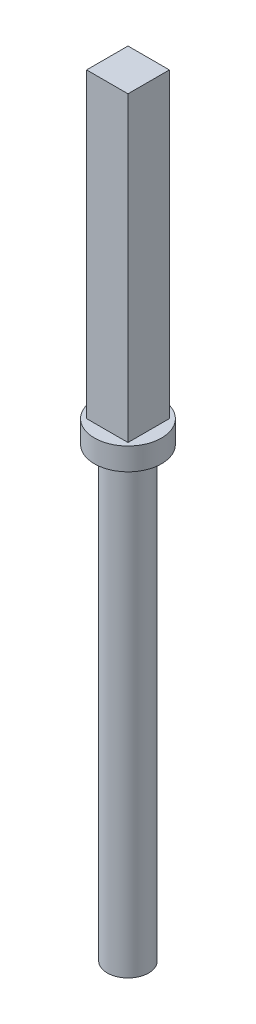
from build123d import *

# Parameters (mm, degrees)
SKETCH2_R           = 1.85
BOSS_EXTRUDE1_DEPTH = 40
SKETCH3_R           = 3
BOSS_EXTRUDE2_DEPTH = 2
SKETCH4_W           = 3.7
SKETCH4_H           = 3.7
BOSS_EXTRUDE3_DEPTH = 27


with BuildPart() as part:
    # Sketch2 → Boss-Extrude1 (new body)
    with BuildSketch(Plane(origin=(0, 0, 0), x_dir=(1, 0, 0), z_dir=(0, 1, 0))):
        with Locations(Location((0, 0, 0), (0, 0, 270))):
            Circle(SKETCH2_R)
    extrude(amount=BOSS_EXTRUDE1_DEPTH)

    # Sketch3 → Boss-Extrude2 (add)
    with BuildSketch(Plane(origin=(0, 40, 0), x_dir=(1, 0, 0), z_dir=(0, 1, 0))):
        with Locations(Location((0, 0, 0), (0, 0, 270))):
            Circle(SKETCH3_R)
    extrude(amount=BOSS_EXTRUDE2_DEPTH)

    # Sketch4 → Boss-Extrude3 (add)
    with BuildSketch(Plane(origin=(0, 42, 0), x_dir=(1, 0, 0), z_dir=(0, 1, 0))):
        Rectangle(SKETCH4_W, SKETCH4_H)
    extrude(amount=BOSS_EXTRUDE3_DEPTH)


solid = part.part
